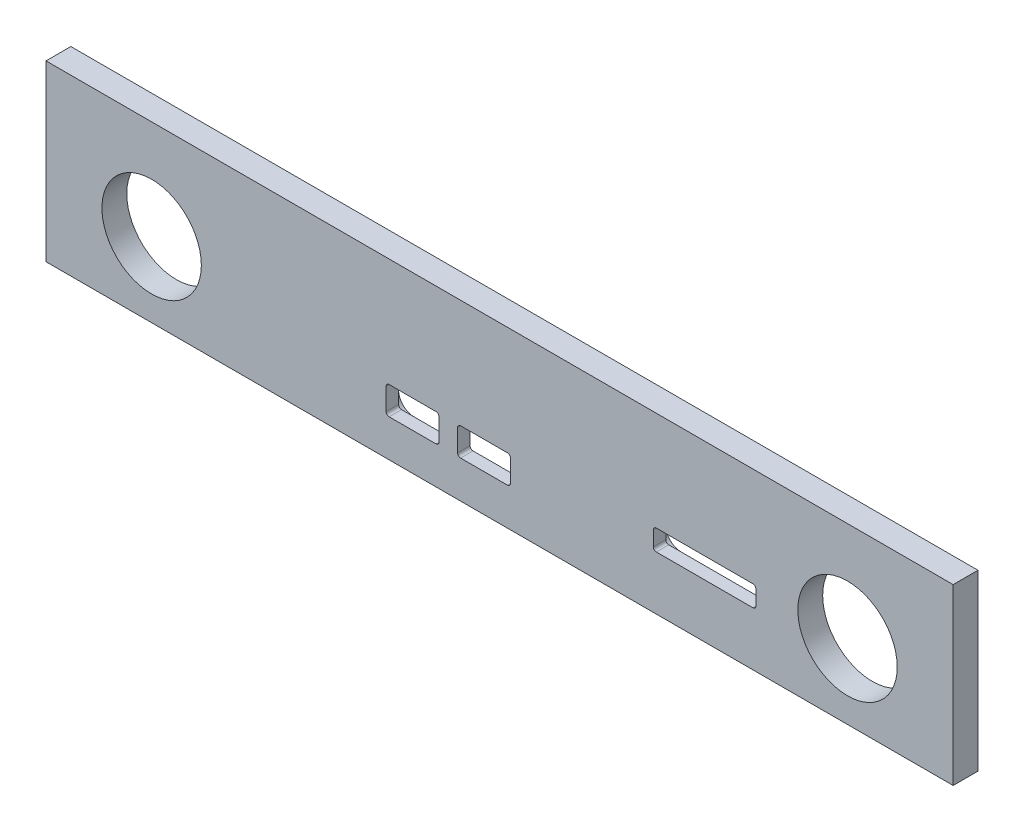
from build123d import *

# Parameters (mm, degrees)
SKETCH1_W           = 231.775
SKETCH1_H           = 44.45
BOSS_EXTRUDE1_DEPTH = 6.35
CUT_EXTRUDE1_REACH  = 120.17
SKETCH2_R           = 12.7
SKETCH2_W           = 13.49375
SKETCH2_H           = 7.14375
SKETCH2_W_2         = 26.19375
SKETCH2_H_2         = 5.30225
FILLET1_R           = 0.762
CUT_EXTRUDE2_DEPTH  = 3.175
CUT_EXTRUDE3_DEPTH  = 3.175


with BuildPart() as part:
    # Sketch1 → Boss-Extrude1 (new body)
    with BuildSketch(Plane.XY):
        Rectangle(SKETCH1_W, SKETCH1_H)
    extrude(amount=BOSS_EXTRUDE1_DEPTH)

    # Sketch2 → Cut-Extrude1 (cut, up to next)
    with BuildSketch(Plane.XY.offset(6.35), mode=Mode.PRIVATE) as cut_extrude1_sk1:
        with Locations((88.9, -3.175)):
            Circle(SKETCH2_R)
    cut_extrude1_tool1 = extrude(cut_extrude1_sk1.sketch, amount=-CUT_EXTRUDE1_REACH, mode=Mode.PRIVATE) & part.part
    # Sketch2 → Cut-Extrude1 (cut, up to next)
    with BuildSketch(Plane.XY.offset(6.35), mode=Mode.PRIVATE) as cut_extrude1_sk2:
        with Locations((-88.9, -3.175)):
            Circle(SKETCH2_R)
    cut_extrude1_tool2 = extrude(cut_extrude1_sk2.sketch, amount=-CUT_EXTRUDE1_REACH, mode=Mode.PRIVATE) & part.part
    # Sketch2 → Cut-Extrude1 (cut, up to next)
    with BuildSketch(Plane.XY.offset(6.35), mode=Mode.PRIVATE) as cut_extrude1_sk3:
        with Locations((-22.225, -9.128125)):
            Rectangle(SKETCH2_W, SKETCH2_H)
    cut_extrude1_tool3 = extrude(cut_extrude1_sk3.sketch, amount=-CUT_EXTRUDE1_REACH, mode=Mode.PRIVATE) & part.part
    # Sketch2 → Cut-Extrude1 (cut, up to next)
    with BuildSketch(Plane.XY.offset(6.35), mode=Mode.PRIVATE) as cut_extrude1_sk4:
        with Locations((-3.96875, -9.128125)):
            Rectangle(SKETCH2_W, SKETCH2_H)
    cut_extrude1_tool4 = extrude(cut_extrude1_sk4.sketch, amount=-CUT_EXTRUDE1_REACH, mode=Mode.PRIVATE) & part.part
    # Sketch2 → Cut-Extrude1 (cut, up to next)
    with BuildSketch(Plane.XY.offset(6.35), mode=Mode.PRIVATE) as cut_extrude1_sk5:
        with Locations((52.3875, -5.826125)):
            Rectangle(SKETCH2_W_2, SKETCH2_H_2)
    cut_extrude1_tool5 = extrude(cut_extrude1_sk5.sketch, amount=-CUT_EXTRUDE1_REACH, mode=Mode.PRIVATE) & part.part
    add(cut_extrude1_tool1.solids().sort_by_distance((88.9, -3.175, 6.35))[0], mode=Mode.SUBTRACT)
    add(cut_extrude1_tool2.solids().sort_by_distance((-88.9, -3.175, 6.35))[0], mode=Mode.SUBTRACT)
    add(cut_extrude1_tool3.solids().sort_by_distance((-22.225, -9.128125, 6.35))[0], mode=Mode.SUBTRACT)
    add(cut_extrude1_tool4.solids().sort_by_distance((-3.96875, -9.128125, 6.35))[0], mode=Mode.SUBTRACT)
    add(cut_extrude1_tool5.solids().sort_by_distance((52.3875, -5.826125, 6.35))[0], mode=Mode.SUBTRACT)

    # Fillet1
    fillet1_edges = [part.edges().sort_by_distance(p)[0] for p in [
        (-28.971875, -5.55625, 3.175),
        (-15.478125, -5.55625, 3.175),
        (-15.478125, -12.7, 3.175),
        (-28.971875, -12.7, 3.175),
        (-10.715625, -12.7, 3.175),
        (-10.715625, -5.55625, 3.175),
        (2.778125, -5.55625, 3.175),
        (2.778125, -12.7, 3.175),
        (39.290625, -8.47725, 3.175),
        (39.290625, -3.175, 3.175),
        (65.484375, -3.175, 3.175),
        (65.484375, -8.47725, 3.175),
    ]]
    fillet(fillet1_edges, radius=FILLET1_R)

    # Sketch3 → Cut-Extrude2 (cut)
    with BuildSketch(Plane(origin=(0, 0, 0), x_dir=(-1, 0, 0), z_dir=(0, 0, -1))):
        with BuildLine():
            Line((-64.722375, -11.65225), (-40.052625, -11.65225))
            ThreePointArc((-40.052625, -11.65225), (-37.268745602, -10.499129398), (-36.115625, -7.71525))
            Line((-36.115625, -7.71525), (-36.115625, -3.937))
            ThreePointArc((-36.115625, -3.937), (-37.268745602, -1.153120602), (-40.052625, 0))
            Line((-40.052625, 0), (-64.722375, 0))
            ThreePointArc((-64.722375, 0), (-67.506254398, -1.153120602), (-68.659375, -3.937))
            Line((-68.659375, -3.937), (-68.659375, -7.71525))
            ThreePointArc((-68.659375, -7.71525), (-67.506254398, -10.499129398), (-64.722375, -11.65225))
        make_face()
    extrude(amount=-CUT_EXTRUDE2_DEPTH, mode=Mode.SUBTRACT)

    # Sketch4 → Cut-Extrude3 (cut)
    with BuildSketch(Plane(origin=(0, 0, 0), x_dir=(-1, 0, 0), z_dir=(0, 0, -1))):
        with BuildLine():
            Line((28.209875, -15.875), (-2.016125, -15.875))
            ThreePointArc((-2.016125, -15.875), (-4.800004398, -14.721879398), (-5.953125, -11.938))
            Line((-5.953125, -11.938), (-5.953125, -6.31825))
            ThreePointArc((-5.953125, -6.31825), (-4.800004398, -3.534370602), (-2.016125, -2.38125))
            Line((-2.016125, -2.38125), (28.209875, -2.38125))
            ThreePointArc((28.209875, -2.38125), (30.993754398, -3.534370602), (32.146875, -6.31825))
            Line((32.146875, -6.31825), (32.146875, -11.938))
            ThreePointArc((32.146875, -11.938), (30.993754398, -14.721879398), (28.209875, -15.875))
        make_face()
    extrude(amount=-CUT_EXTRUDE3_DEPTH, mode=Mode.SUBTRACT)


solid = part.part
